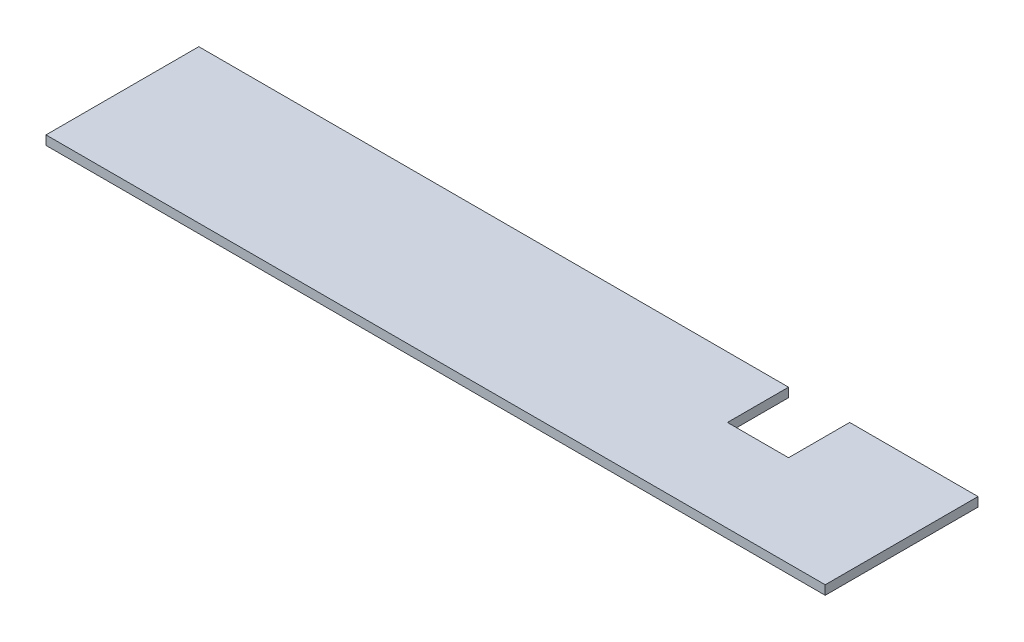
from build123d import *

# Parameters (mm, degrees)
SKETCH1_W           = 255
SKETCH1_H           = 50
BOSS_EXTRUDE1_DEPTH = 3
SKETCH2_W           = 20
SKETCH2_H           = 20
CUT_EXTRUDE1_DEPTH  = 3


with BuildPart() as part:
    # Sketch1 → Boss-Extrude1 (new body)
    with BuildSketch(Plane(origin=(0, 0, 0), x_dir=(1, 0, 0), z_dir=(0, 1, 0))):
        with Locations((85.45321959, -1.483322544)):
            Rectangle(SKETCH1_W, SKETCH1_H)
    extrude(amount=BOSS_EXTRUDE1_DEPTH)

    # Sketch2 → Cut-Extrude1 (cut)
    with BuildSketch(Plane(origin=(0, 3, 0), x_dir=(1, 0, 0), z_dir=(0, 1, 0))):
        with Locations((160.95321959, 13.516677456)):
            Rectangle(SKETCH2_W, SKETCH2_H)
    extrude(amount=-CUT_EXTRUDE1_DEPTH, mode=Mode.SUBTRACT)


solid = part.part
